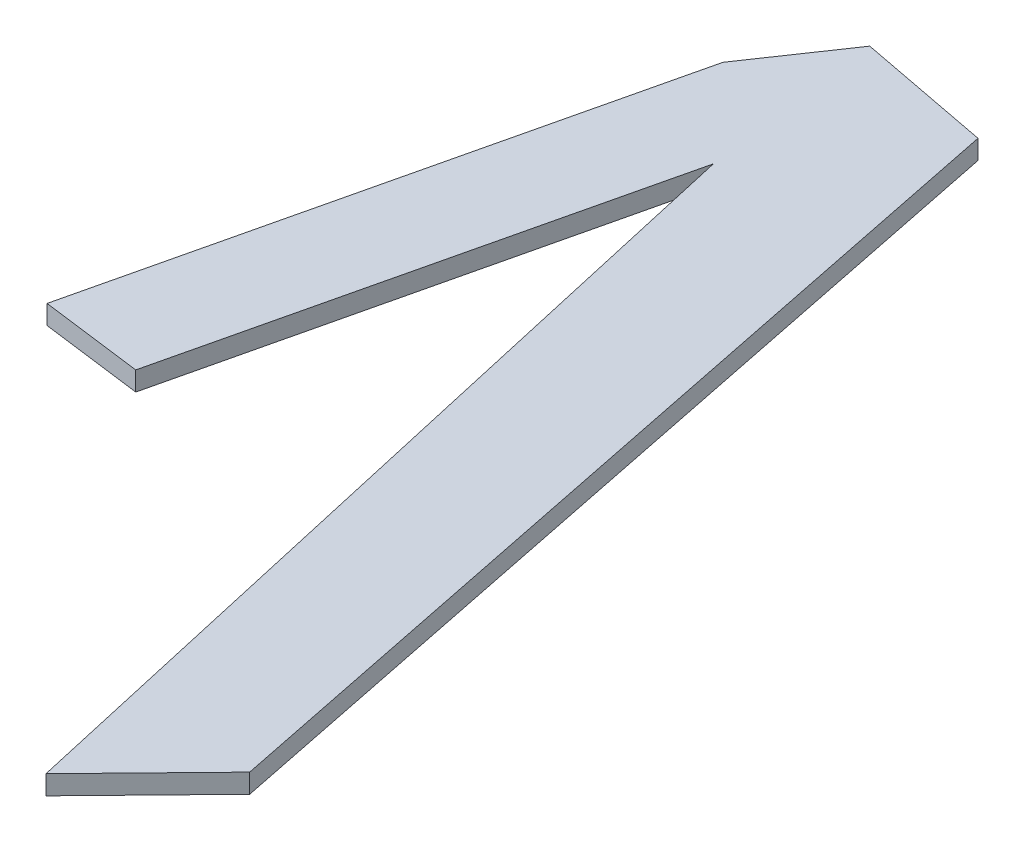
from build123d import *

# Parameters (mm, degrees)
BOSS_EXTRUDE1_DEPTH = 1


with BuildPart() as part:
    # Sketch1 → Boss-Extrude1 (new body)
    with BuildSketch(Plane(origin=(0, 0, 0), x_dir=(1, 0, 0), z_dir=(0, 1, 0))):
        Polygon((0, 0), (-5.745184287, -24.330903343), (-11.050411804, -23.640207322), (-4.328546188, 4.826949589), (-1.235999528, 9.375153098), (5.736984861, 8.038183126), (15.356052313, -39.498366406), (10.124100567, -44.872069127), align=None)
    extrude(amount=BOSS_EXTRUDE1_DEPTH)


solid = part.part
